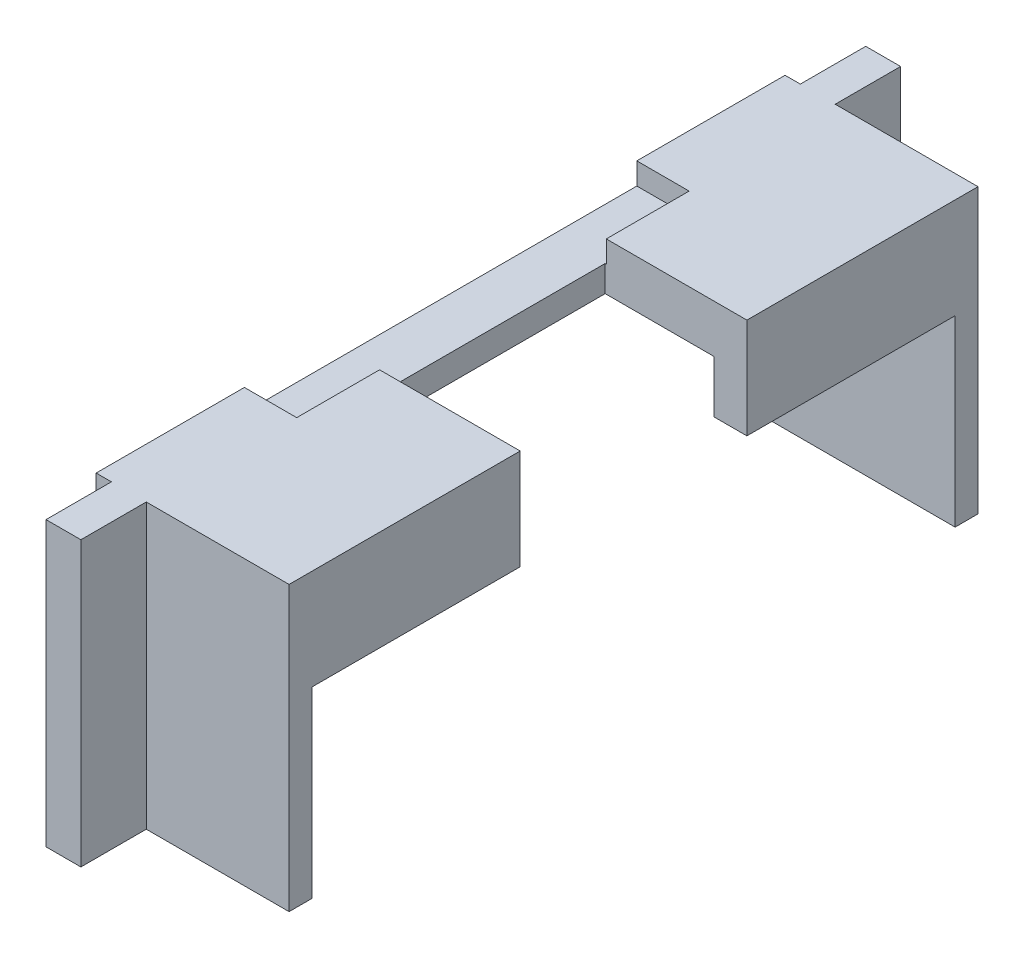
from build123d import *

# Parameters (mm, degrees)
SKETCH1_W           = 38
SKETCH1_H           = 13
BOSS_EXTRUDE1_DEPTH = 3
CUT_EXTRUDE1_DEPTH  = 24.216373532
SKETCH3_W           = 29.5
SKETCH3_H           = 10.8
CUT_EXTRUDE2_DEPTH  = 3
BOSS_EXTRUDE2_DEPTH = 5.85
SKETCH5_W           = 9.75
SKETCH5_H           = 2.4
BOSS_EXTRUDE3_DEPTH = 1.5
CUT_EXTRUDE3_DEPTH  = 10
SKETCH7_W           = 18
SKETCH7_H           = 1
CUT_EXTRUDE4_DEPTH  = 2.4


with BuildPart() as part:
    # Sketch1 → Boss-Extrude1 (new body)
    with BuildSketch(Plane(origin=(0, 0, 0), x_dir=(0, 0, -1), z_dir=(1, 0, 0))):
        with Locations((0, 6.5)):
            Rectangle(SKETCH1_W, SKETCH1_H)
    extrude(amount=BOSS_EXTRUDE1_DEPTH)

    # Sketch2 → Cut-Extrude1 (cut, through all)
    with BuildSketch(Plane(origin=(0, 13, 0), x_dir=(1, 0, 0), z_dir=(0, 1, 0))):
        Polygon((0.7, -18.8), (0.7, -15.8), (0, -15.8), (0, -19), (3, -19), (3, -15.8), (2.3, -15.8), (2.3, -18.8), align=None)
        Polygon((2.3, 18.8), (2.3, 15.8), (3, 15.8), (3, 19), (0, 19), (0, 15.8), (0.7, 15.8), (0.7, 18.8), align=None)
    extrude(amount=-CUT_EXTRUDE1_DEPTH, mode=Mode.SUBTRACT)

    # Sketch3 → Cut-Extrude2 (cut)
    with BuildSketch(Plane(origin=(3, 0, 0), x_dir=(0, 0, -1), z_dir=(1, 0, 0))):
        with Locations((0, 5.4)):
            Rectangle(SKETCH3_W, SKETCH3_H)
    extrude(amount=-CUT_EXTRUDE2_DEPTH, mode=Mode.SUBTRACT)

    # Sketch4 → Boss-Extrude2 (add)
    with BuildSketch(Plane(origin=(3, 0, 0), x_dir=(0, 0, -1), z_dir=(1, 0, 0))):
        Polygon((-15.8, 13), (-15.8, 0), (-14.75, 0), (-14.75, 10.8), (14.75, 10.8), (14.75, 0), (15.8, 0), (15.8, 13), align=None)
    extrude(amount=BOSS_EXTRUDE2_DEPTH)

    # Sketch5 → Boss-Extrude3 (add)
    with BuildSketch(Plane(origin=(8.85, 0, 0), x_dir=(0, 0, -1), z_dir=(1, 0, 0))):
        with Locations((-9.875, 9.6)):
            Rectangle(SKETCH5_W, SKETCH5_H)
        with Locations((9.875, 9.6)):
            Rectangle(SKETCH5_W, SKETCH5_H)
    extrude(amount=-BOSS_EXTRUDE3_DEPTH)

    # Sketch6 → Cut-Extrude3 (cut)
    with BuildSketch(Plane(origin=(0, 13, 0), x_dir=(1, 0, 0), z_dir=(0, 1, 0))):
        Polygon((8.85, 5.2), (2.35, 5.2), (2.35, 0), (2.35, -5.2), (8.85, -5.2), align=None)
    extrude(amount=-CUT_EXTRUDE3_DEPTH, mode=Mode.SUBTRACT)

    # Sketch7 → Cut-Extrude4 (cut)
    with BuildSketch(Plane.ZY):
        with Locations((0, 12.5)):
            Rectangle(SKETCH7_W, SKETCH7_H)
    extrude(amount=-CUT_EXTRUDE4_DEPTH, mode=Mode.SUBTRACT)


solid = part.part
